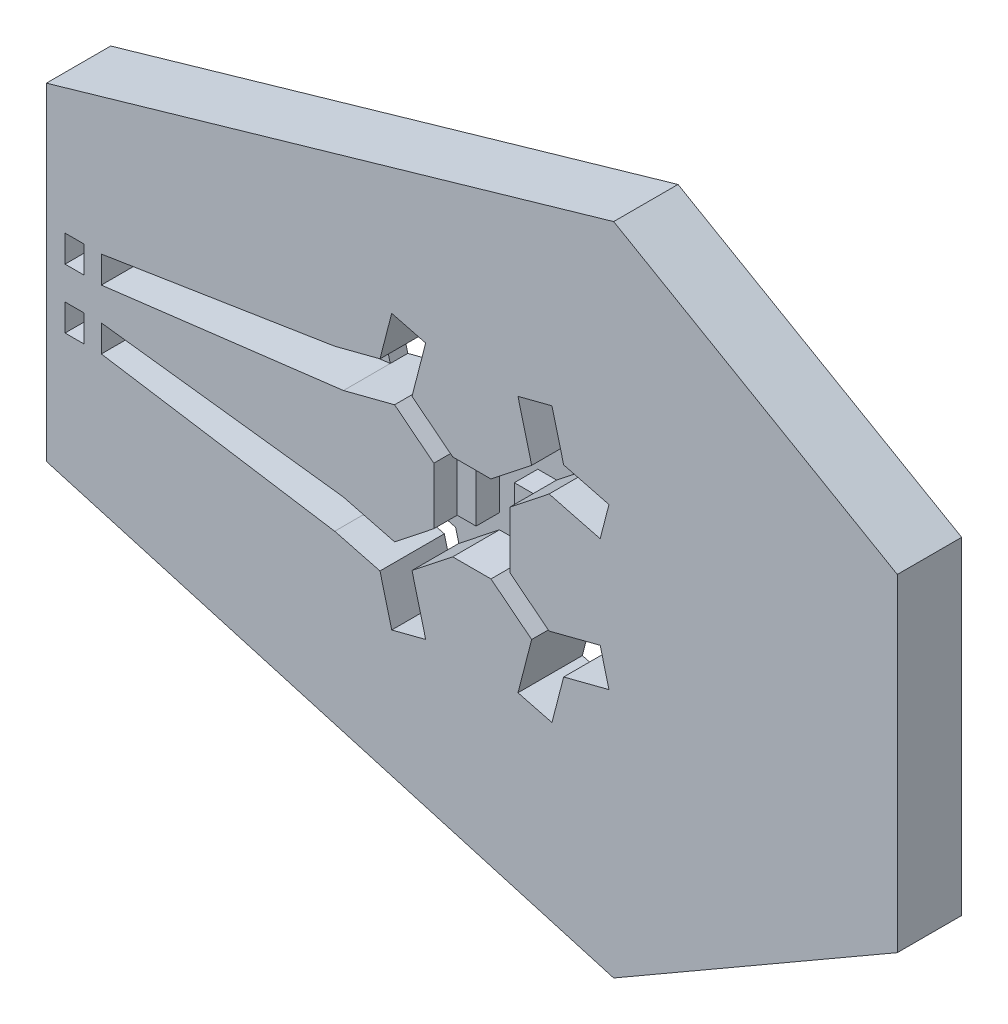
from build123d import *

# Parameters (mm, degrees)
BOSS_EXTRUDE1_DEPTH  = 1.5
BOSS_EXTRUDE2_START  = 1.5
SKETCH1_3_W          = 6.5
SKETCH1_3_H          = 7.4
SKETCH1_3_W_2        = 1.6
SKETCH1_3_H_2        = 2.3
BOSS_EXTRUDE2_DEPTH  = 4
CUT_EXTRUDE1_DEPTH   = 5.5
MIRROR2_COPY_1_DEPTH = 5.5
CUT_EXTRUDE2_DEPTH   = 4
SKETCH6_W            = 1.613740729
SKETCH6_H            = 4.851761748
BOSS_EXTRUDE3_DEPTH  = 2


with BuildPart() as part:
    # Sketch1 → Boss-Extrude1 (new body)
    with BuildSketch(Plane.XY):
        Polygon((6.974355653, -28), (31.223066959, -14), (31.223066959, 14), (6.974355653, 28), (-41.523066959, 14), (-41.523066959, -14), align=None)
    extrude(amount=BOSS_EXTRUDE1_DEPTH)

    # Sketch1<3> → Boss-Extrude2 (add)
    with BuildSketch(Plane.XY.offset(BOSS_EXTRUDE2_START)):
        Polygon((6.974355653, 28), (-41.523066959, 14), (-41.523066959, -14), (6.974355653, -28), (31.223066959, -14), (31.223066959, 14), align=None)
        with Locations((-5.15, 0)):
            Rectangle(SKETCH1_3_W, SKETCH1_3_H, mode=Mode.SUBTRACT)
        with Locations((-39.123066959, -2.55)):
            Rectangle(SKETCH1_3_W_2, SKETCH1_3_H_2, mode=Mode.SUBTRACT)
        with Locations((-39.123066959, 2.55)):
            Rectangle(SKETCH1_3_W_2, SKETCH1_3_H_2, mode=Mode.SUBTRACT)
    extrude(amount=BOSS_EXTRUDE2_DEPTH)

    # WireCutExtrude → Cut-Extrude1 (cut)
    with BuildSketch(Plane.XY.offset(5.5)):
        Polygon((-9.094946311, 10.972481296), (-10.538213003, 5.388213003), (-16.122481296, 3.944946311), (-16.873171174, 6.849505608), (-13.000425446, 7.850425446), (-11.999505608, 11.723171174), align=None)
    cut_extrude1 = extrude(amount=-CUT_EXTRUDE1_DEPTH, mode=Mode.SUBTRACT)

    # Mirror1: Cut-Extrude1 across plane
    add(cut_extrude1.mirror(Plane(origin=(0, 0, 0), x_dir=(0, 0, 1), z_dir=(0, -1, 0))), mode=Mode.SUBTRACT)

    # Mirror2: Cut-Extrude1 across plane
    add(cut_extrude1.mirror(Plane(origin=(-5.15, 0, 0), x_dir=(0, 0, 1), z_dir=(1, 0, 0))), mode=Mode.SUBTRACT)

    # Mirror2 copy 1 sketch → Mirror2 copy 1 (cut)
    with BuildSketch(Plane(origin=(-10.3, 0, 5.5), x_dir=(-1, 0, 0), z_dir=(0, 0, 1))):
        Polygon((-9.094946311, 10.972481296), (-10.538213003, 5.388213003), (-16.122481296, 3.944946311), (-16.873171174, 6.849505608), (-13.000425446, 7.850425446), (-11.999505608, 11.723171174), align=None)
    extrude(amount=-MIRROR2_COPY_1_DEPTH, mode=Mode.SUBTRACT)

    # Sketch5 → Cut-Extrude2 (cut)
    with BuildSketch(Plane.XY.offset(5.5)):
        Polygon((-10.264722381, 6.44639928), (-6.786259271, 3.7), (-8.4, 3.7), (-8.4, 2.425880874), (-11.753980013, 5.073995286), (-10.538213003, 5.388213003), align=None)
        Polygon((-3.513740729, 3.7), (-0.035277619, 6.44639928), (0.238213003, 5.388213003), (1.453980013, 5.073995286), (-1.9, 2.425880874), (-1.9, 3.7), align=None)
        Polygon((-36.823066959, 1.4), (-36.823066959, 3.7), (-16.873171174, 6.849505608), (-16.122481296, 3.944946311), align=None)
    cut_extrude2 = extrude(amount=-CUT_EXTRUDE2_DEPTH, mode=Mode.SUBTRACT)

    # Mirror3: Cut-Extrude2 across plane
    add(cut_extrude2.mirror(Plane(origin=(0, 0, 0), x_dir=(0, 0, 1), z_dir=(0, -1, 0))), mode=Mode.SUBTRACT)

    # Sketch6 → Boss-Extrude3 (add)
    with BuildSketch(Plane.XY.offset(1.5)):
        with Locations((-2.706870365, 0)):
            Rectangle(SKETCH6_W, SKETCH6_H)
        with Locations((-7.593129636, 0)):
            Rectangle(SKETCH6_W, SKETCH6_H)
    extrude(amount=BOSS_EXTRUDE3_DEPTH)


solid = part.part
